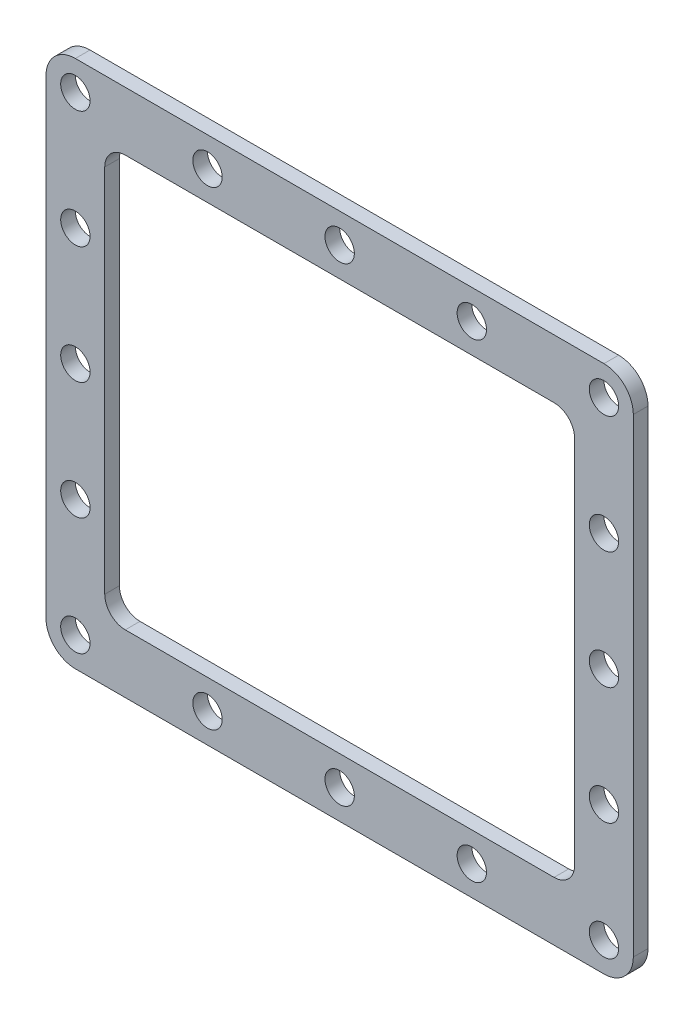
from build123d import *

# Parameters (mm, degrees)
SKETCH_1_R      = 5
EXTRUDE_1_DEPTH = 5


with BuildPart() as part:
    # 草图1 → 凸台-拉伸1 (new body)
    with BuildSketch(Plane.XY):
        with BuildLine():
            Line((-90, -90), (90, -90))
            ThreePointArc((90, -90), (97.071067812, -87.071067812), (100, -80))
            Line((100, -80), (100, 80))
            ThreePointArc((100, 80), (97.071067812, 87.071067812), (90, 90))
            Line((90, 90), (-90, 90))
            ThreePointArc((-90, 90), (-97.071067812, 87.071067812), (-100, 80))
            Line((-100, 80), (-100, -80))
            ThreePointArc((-100, -80), (-97.071067812, -87.071067812), (-90, -90))
        make_face()
        with Locations((90, -80)):
            Circle(SKETCH_1_R, mode=Mode.SUBTRACT)
        with Locations((90, 80)):
            Circle(SKETCH_1_R, mode=Mode.SUBTRACT)
        with Locations((-90, 80)):
            Circle(SKETCH_1_R, mode=Mode.SUBTRACT)
        with Locations((-90, -80)):
            Circle(SKETCH_1_R, mode=Mode.SUBTRACT)
        with Locations((90, 0)):
            Circle(SKETCH_1_R, mode=Mode.SUBTRACT)
        with Locations((90, -40)):
            Circle(SKETCH_1_R, mode=Mode.SUBTRACT)
        with Locations((90, 40)):
            Circle(SKETCH_1_R, mode=Mode.SUBTRACT)
        with Locations(Location((-90, -40, 0), (0, 0, 180))):
            Circle(SKETCH_1_R, mode=Mode.SUBTRACT)
        with Locations(Location((-90, 0, 0), (0, 0, 180))):
            Circle(SKETCH_1_R, mode=Mode.SUBTRACT)
        with Locations(Location((-90, 40, 0), (0, 0, 180))):
            Circle(SKETCH_1_R, mode=Mode.SUBTRACT)
        with Locations((0, 80)):
            Circle(SKETCH_1_R, mode=Mode.SUBTRACT)
        with Locations((-45, 80)):
            Circle(SKETCH_1_R, mode=Mode.SUBTRACT)
        with Locations((45, 80)):
            Circle(SKETCH_1_R, mode=Mode.SUBTRACT)
        with Locations((0, -80)):
            Circle(SKETCH_1_R, mode=Mode.SUBTRACT)
        with Locations((-45, -80)):
            Circle(SKETCH_1_R, mode=Mode.SUBTRACT)
        with Locations((45, -80)):
            Circle(SKETCH_1_R, mode=Mode.SUBTRACT)
        with BuildLine():
            Line((-73, -70), (73, -70))
            ThreePointArc((73, -70), (77.949747468, -67.949747468), (80, -63))
            Line((80, -63), (80, 63))
            ThreePointArc((80, 63), (77.949747468, 67.949747468), (73, 70))
            Line((73, 70), (-73, 70))
            ThreePointArc((-73, 70), (-77.949747468, 67.949747468), (-80, 63))
            Line((-80, 63), (-80, -63))
            ThreePointArc((-80, -63), (-77.949747468, -67.949747468), (-73, -70))
        make_face(mode=Mode.SUBTRACT)
    extrude(amount=EXTRUDE_1_DEPTH)


solid = part.part
